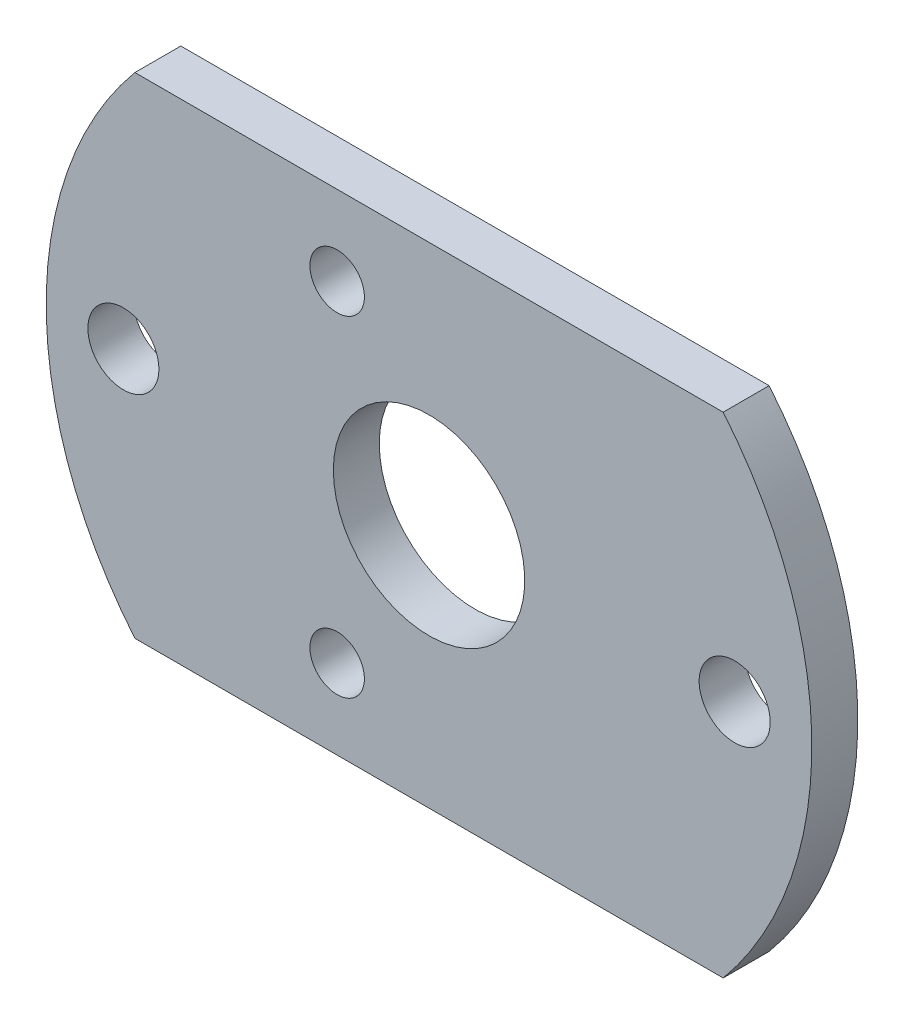
from build123d import *

# Parameters (mm, degrees)
SKETCH1_R             = 15.875
SKETCH1_R_2           = 3.96875
BOSS_EXTRUDE1_DEPTH   = 1.905
MOTORCLEARANCEHOLES_D = 2.9464
ENCODERSETSCREWS_D    = 2.2606
LINACTCUTAWAY_DEPTH   = 23.531317649


with BuildPart() as part:
    # Sketch1 → Boss-Extrude1 (new body)
    with BuildSketch(Plane.XY):
        with Locations(Location((0, 0, 0), (0, 0, 180))):
            Circle(SKETCH1_R)
        with Locations(Location((0, 0, 0), (0, 0, 180))):
            Circle(SKETCH1_R_2, mode=Mode.SUBTRACT)
    extrude(amount=BOSS_EXTRUDE1_DEPTH)

    # MotorClearanceHoles (through all)
    with Locations(Plane.XY.offset(1.905)):
        with Locations((-12.6746, 0), (12.6746, 0)):
            Hole(MOTORCLEARANCEHOLES_D / 2)

    # EncoderSetScrews (through all)
    with Locations(Plane.XY.offset(1.905)):
        with Locations((-3.81, 6.858), (-3.81, -6.858)):
            Hole(ENCODERSETSCREWS_D / 2)

    # Sketch8 → LinActCutaway (cut, through all)
    with BuildSketch(Plane.XY.offset(1.905)):
        with BuildLine():
            Line((-12.197951672, -10.16), (12.197951672, -10.16))
            ThreePointArc((12.197951672, -10.16), (0, -15.875), (-12.197951672, -10.16))
        make_face()
        with BuildLine():
            Line((-12.197951672, 10.16), (12.197951672, 10.16))
            ThreePointArc((12.197951672, 10.16), (0, 15.875), (-12.197951672, 10.16))
        make_face()
    extrude(amount=-LINACTCUTAWAY_DEPTH, mode=Mode.SUBTRACT)


solid = part.part
